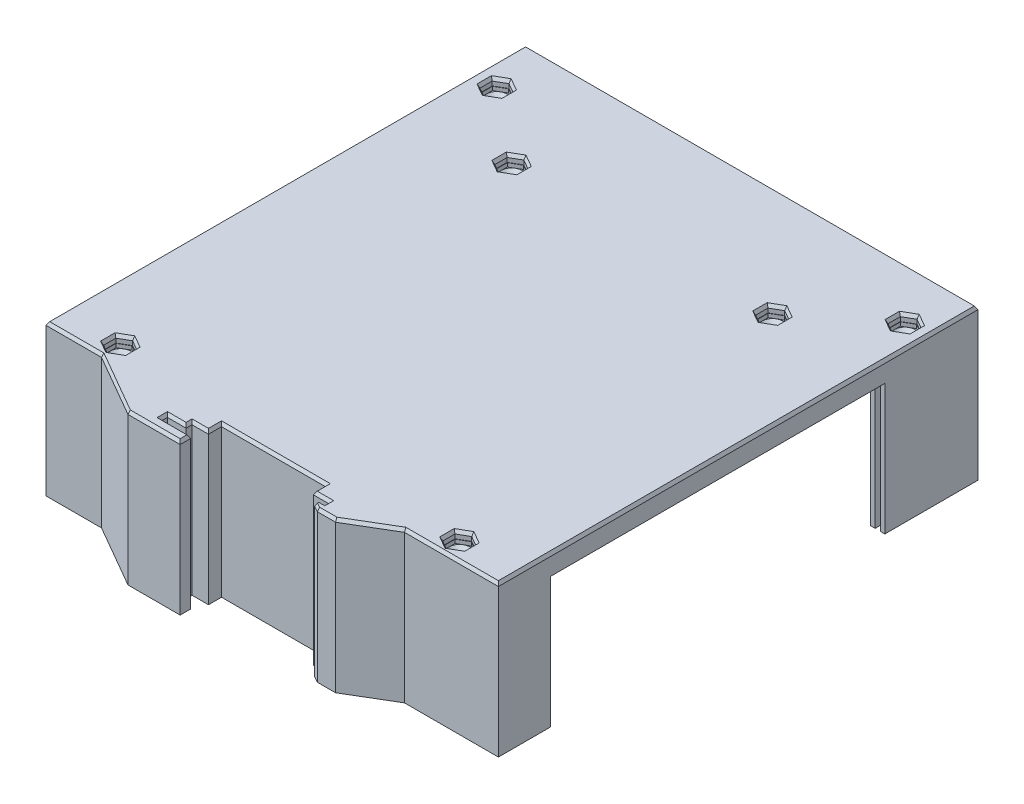
from build123d import *

# Parameters (mm, degrees)
SKETCH_1_W            = 121.4
SKETCH_1_H            = 128.7
EXTRUDE_1_DEPTH       = 1.5
SKETCH_2_W            = 121.4
SKETCH_2_H            = 128.7
SKETCH_2_W_2          = 113.8
SKETCH_2_H_2          = 116.9
SKETCH_2_W_3          = 36
SKETCH_2_H_3          = 4.6
SKETCH_2_W_4          = 20
EXTRUDE_2_DEPTH       = 2
SKETCH_3_W            = 1.5
SKETCH_3_H            = 96.8
SKETCH_3_W_2          = 113.8
SKETCH_3_H_2          = 1.5
EXTRUDE_3_DEPTH       = 2
EXTRUDE_4_DEPTH       = 35
SKETCH_5_R            = 3.15
EXTRUDE_5_DEPTH       = 39
EXTRUDE_6_REACH       = 183.17
SKETCH_6_R            = 4.75
SKETCH_7_W            = 121.4
SKETCH_7_H            = 8
SKETCH_7_W_2          = 36
SKETCH_7_H_2          = 4.6
SKETCH_7_W_3          = 20
EXTRUDE_7_DEPTH       = 37
EXTRUDE_15_DEPTH      = 3.8
SKETCH_9_R            = 4.75
SKETCH_9_W            = 2.2
SKETCH_9_H            = 2.2
EXTRUDE_9_DEPTH       = 4
CUT_EXTRUDE_1_REACH   = 184.385
SKETCH_10_R           = 1.75
CUT_EXTRUDE_2_DEPTH   = 3
EXTRUDE_10_DEPTH      = 40.5
EXTRUDE_11_DEPTH      = 40.5
CHAMFER_2_SIZE        = 1
CHAMFER_3_SIZE        = 0.5
CHAMFER_3_SIZE2       = 0.866025404
CHAMFER_4_SIZE        = 0.5
CHAMFER_4_SIZE2       = 0.866025404
EXTRUDE_12_REACH      = 184.026
EXTRUDE_13_DEPTH      = 2.2
EXTRUDE_13_DEPTH_BACK = 2.2
EXTRUDE_14_DEPTH      = 2.2
EXTRUDE_14_DEPTH_BACK = 2.2
EXTRUDE_16_DEPTH      = 1


with BuildPart() as part:
    # Эскиз1 → Бобышка-Вытянуть1 (new body)
    with BuildSketch(Plane(origin=(0, 0, 0), x_dir=(1, 0, 0), z_dir=(0, 1, 0))):
        with Locations((60.7, 64.35)):
            Rectangle(SKETCH_1_W, SKETCH_1_H)
    extrude(amount=EXTRUDE_1_DEPTH)

    # Эскиз2 → Бобышка-Вытянуть2 (add)
    with BuildSketch(Plane.XZ):
        with Locations((60.7, -64.35)):
            Rectangle(SKETCH_2_W, SKETCH_2_H)
        with Locations((60.7, -66.45)):
            Rectangle(SKETCH_2_W_2, SKETCH_2_H_2, mode=Mode.SUBTRACT)
        with Locations((101.7, -4)):
            Rectangle(SKETCH_2_W_3, SKETCH_2_H_3, mode=Mode.SUBTRACT)
        with Locations((19.7, -4)):
            Rectangle(SKETCH_2_W_3, SKETCH_2_H_3, mode=Mode.SUBTRACT)
        with Locations((71.7, -4)):
            Rectangle(SKETCH_2_W_4, SKETCH_2_H_3, mode=Mode.SUBTRACT)
        with Locations((49.7, -4)):
            Rectangle(SKETCH_2_W_4, SKETCH_2_H_3, mode=Mode.SUBTRACT)
    extrude(amount=EXTRUDE_2_DEPTH)

    # Эскиз3 → Бобышка-Вытянуть3 (add)
    with BuildSketch(Plane.XZ.offset(2)):
        Polygon((117.6, -8), (121.4, -8), (121.4, -128.7), (0, -128.7), (0, -8), (3.8, -8), (3.8, -124.9), (117.6, -124.9), align=None)
        with Locations((119.55, -59)):
            Rectangle(SKETCH_3_W, SKETCH_3_H, mode=Mode.SUBTRACT)
        with Locations((60.7, -126.85)):
            Rectangle(SKETCH_3_W_2, SKETCH_3_H_2, mode=Mode.SUBTRACT)
        with Locations((1.85, -59)):
            Rectangle(SKETCH_3_W, SKETCH_3_H, mode=Mode.SUBTRACT)
    extrude(amount=EXTRUDE_3_DEPTH)

    # Эскиз4 → Бобышка-Вытянуть4 (add)
    with BuildSketch(Plane.XZ.offset(4)):
        Polygon((121.4, -8), (121.4, -14), (120.3, -14), (120.3, -10.6), (118.8, -10.6), (118.8, -14), (117.6, -14), (117.6, -8), align=None)
        Polygon((3.8, -8), (0, -8), (0, -14), (1.1, -14), (1.1, -10.6), (2.6, -10.6), (2.6, -14), (3.8, -14), align=None)
        Polygon((121.4, -128.7), (121.4, -103.7), (120.3, -103.7), (120.3, -107.4), (118.8, -107.4), (118.8, -103.7), (117.6, -103.7), (117.6, -124.9), (113.4, -124.9), (113.4, -126.1), (117.6, -126.1), (117.6, -127.6), (113.4, -127.6), (113.4, -128.7), align=None)
        Polygon((8, -124.9), (3.8, -124.9), (3.8, -103.7), (2.6, -103.7), (2.6, -107.4), (1.1, -107.4), (1.1, -103.7), (0, -103.7), (0, -128.7), (8, -128.7), (8, -127.6), (3.8, -127.6), (3.8, -126.1), (8, -126.1), align=None)
    extrude(amount=EXTRUDE_4_DEPTH)

    # Эскиз5 → Бобышка-Вытянуть5 (add)
    with BuildSketch(Plane.XZ):
        with Locations(Location((106.2, -4.75, 0), (0, 0, 75.52435158))):
            Circle(SKETCH_5_R)
        with Locations(Location((15.2, -4.75, 0), (0, 0, 104.47564842))):
            Circle(SKETCH_5_R)
        with Locations((115.45, -115)):
            Circle(SKETCH_5_R)
        with Locations((5.95, -115)):
            Circle(SKETCH_5_R)
    extrude(amount=EXTRUDE_5_DEPTH)

    # Бобышка-Вытянуть6: up to this face of the body (flat: up to its plane)
    extrude_6_end = Plane(part.part.faces().sort_by_distance((118.2, -4, -58.85))[0])
    # Эскиз6 → Бобышка-Вытянуть6 (add, up to the picked face)
    with BuildSketch(Plane.XZ, mode=Mode.PRIVATE) as extrude_6_sk1:
        with Locations((115.45, -115)):
            Circle(SKETCH_6_R)
    extrude_6_tool1 = split(extrude(extrude_6_sk1.sketch, amount=EXTRUDE_6_REACH, mode=Mode.PRIVATE), bisect_by=extrude_6_end, keep=Keep.BOTH, mode=Mode.PRIVATE)
    # Эскиз6 → Бобышка-Вытянуть6 (add, up to the picked face)
    with BuildSketch(Plane.XZ, mode=Mode.PRIVATE) as extrude_6_sk2:
        with Locations(Location((106.2, -4.75, 0), (0, 0, 90))):
            Circle(SKETCH_6_R)
    extrude_6_tool2 = split(extrude(extrude_6_sk2.sketch, amount=EXTRUDE_6_REACH, mode=Mode.PRIVATE), bisect_by=extrude_6_end, keep=Keep.BOTH, mode=Mode.PRIVATE)
    # Эскиз6 → Бобышка-Вытянуть6 (add, up to the picked face)
    with BuildSketch(Plane.XZ, mode=Mode.PRIVATE) as extrude_6_sk3:
        with Locations(Location((15.2, -4.75, 0), (0, 0, 90))):
            Circle(SKETCH_6_R)
    extrude_6_tool3 = split(extrude(extrude_6_sk3.sketch, amount=EXTRUDE_6_REACH, mode=Mode.PRIVATE), bisect_by=extrude_6_end, keep=Keep.BOTH, mode=Mode.PRIVATE)
    # Эскиз6 → Бобышка-Вытянуть6 (add, up to the picked face)
    with BuildSketch(Plane.XZ, mode=Mode.PRIVATE) as extrude_6_sk4:
        with Locations((5.95, -115)):
            Circle(SKETCH_6_R)
    extrude_6_tool4 = split(extrude(extrude_6_sk4.sketch, amount=EXTRUDE_6_REACH, mode=Mode.PRIVATE), bisect_by=extrude_6_end, keep=Keep.BOTH, mode=Mode.PRIVATE)
    add(extrude_6_tool1.solids().sort_by(Axis((115.45, 0, -115), (0, -1, 0)))[0])
    add(extrude_6_tool2.solids().sort_by(Axis((106.2, 0, -4.75), (0, -1, 0)))[0])
    add(extrude_6_tool3.solids().sort_by(Axis((15.2, 0, -4.75), (0, -1, 0)))[0])
    add(extrude_6_tool4.solids().sort_by(Axis((5.95, 0, -115), (0, -1, 0)))[0])

    # Эскиз7 → Бобышка-Вытянуть7 (add)
    with BuildSketch(Plane.XZ.offset(2)):
        with Locations((60.7, -4)):
            Rectangle(SKETCH_7_W, SKETCH_7_H)
        with Locations((101.7, -4)):
            Rectangle(SKETCH_7_W_2, SKETCH_7_H_2, mode=Mode.SUBTRACT)
        with Locations((71.7, -4)):
            Rectangle(SKETCH_7_W_3, SKETCH_7_H_2, mode=Mode.SUBTRACT)
        with Locations((49.7, -4)):
            Rectangle(SKETCH_7_W_3, SKETCH_7_H_2, mode=Mode.SUBTRACT)
        with Locations((19.7, -4)):
            Rectangle(SKETCH_7_W_2, SKETCH_7_H_2, mode=Mode.SUBTRACT)
    extrude(amount=EXTRUDE_7_DEPTH)

    # Эскиз8 → Бобышка-Вытянуть15 (add)
    with BuildSketch(Plane.XZ.offset(39)):
        Polygon((83.7, -8), (83.7, -1.7), (81.7, -1.7), (81.7, -6.3), (39.7, -6.3), (39.7, -1.7), (37.7, -1.7), (37.7, -8), align=None)
    extrude(amount=EXTRUDE_15_DEPTH)

    # Эскиз9 → Бобышка-Вытянуть9 (add)
    with BuildSketch(Plane.XZ):
        with Locations(Location((95.7, -99.24, 0), (0, 0, 90))):
            Circle(SKETCH_9_R)
        with Locations(Location((25.7, -99.24, 0), (0, 0, 90))):
            Circle(SKETCH_9_R)
        with Locations((60.7, -123.8)):
            Rectangle(SKETCH_9_W, SKETCH_9_H)
        with Locations((102.9, -123.8)):
            Rectangle(SKETCH_9_W, SKETCH_9_H)
        with Locations((18.5, -123.8)):
            Rectangle(SKETCH_9_W, SKETCH_9_H)
        with Locations((116.5, -99.3)):
            Rectangle(SKETCH_9_W, SKETCH_9_H)
        with Locations((116.5, -17.1)):
            Rectangle(SKETCH_9_W, SKETCH_9_H)
        with Locations((60.7, -9.1)):
            Rectangle(SKETCH_9_W, SKETCH_9_H)
        with Locations((4.9, -17.1)):
            Rectangle(SKETCH_9_W, SKETCH_9_H)
        with Locations((4.9, -99.3)):
            Rectangle(SKETCH_9_W, SKETCH_9_H)
    extrude(amount=EXTRUDE_9_DEPTH)

    # Вырез-Вытянуть1: up to this face of the body (flat: up to its plane)
    cut_extrude_1_end = Plane(part.part.faces().sort_by_distance((118.237912368, -39, -117.203937883))[0])
    # Эскиз10 → Вырез-Вытянуть1 (cut, up to the picked face)
    with BuildSketch(Plane(origin=(0, 1.5, 0), x_dir=(1, 0, 0), z_dir=(0, 1, 0)), mode=Mode.PRIVATE) as cut_extrude_1_sk1:
        with Locations(Location((5.95, 115, 0), (0, 0, 270))):
            Circle(SKETCH_10_R)
    cut_extrude_1_tool1 = split(extrude(cut_extrude_1_sk1.sketch, amount=-CUT_EXTRUDE_1_REACH, mode=Mode.PRIVATE), bisect_by=cut_extrude_1_end, keep=Keep.BOTH, mode=Mode.PRIVATE)
    # Эскиз10 → Вырез-Вытянуть1 (cut, up to the picked face)
    with BuildSketch(Plane(origin=(0, 1.5, 0), x_dir=(1, 0, 0), z_dir=(0, 1, 0)), mode=Mode.PRIVATE) as cut_extrude_1_sk2:
        with Locations(Location((115.45, 115, 0), (0, 0, 270))):
            Circle(SKETCH_10_R)
    cut_extrude_1_tool2 = split(extrude(cut_extrude_1_sk2.sketch, amount=-CUT_EXTRUDE_1_REACH, mode=Mode.PRIVATE), bisect_by=cut_extrude_1_end, keep=Keep.BOTH, mode=Mode.PRIVATE)
    # Эскиз10 → Вырез-Вытянуть1 (cut, up to the picked face)
    with BuildSketch(Plane(origin=(0, 1.5, 0), x_dir=(1, 0, 0), z_dir=(0, 1, 0)), mode=Mode.PRIVATE) as cut_extrude_1_sk3:
        with Locations(Location((15.2, 4.75, 0), (0, 0, 270))):
            Circle(SKETCH_10_R)
    cut_extrude_1_tool3 = split(extrude(cut_extrude_1_sk3.sketch, amount=-CUT_EXTRUDE_1_REACH, mode=Mode.PRIVATE), bisect_by=cut_extrude_1_end, keep=Keep.BOTH, mode=Mode.PRIVATE)
    # Эскиз10 → Вырез-Вытянуть1 (cut, up to the picked face)
    with BuildSketch(Plane(origin=(0, 1.5, 0), x_dir=(1, 0, 0), z_dir=(0, 1, 0)), mode=Mode.PRIVATE) as cut_extrude_1_sk4:
        with Locations(Location((106.2, 4.75, 0), (0, 0, 270))):
            Circle(SKETCH_10_R)
    cut_extrude_1_tool4 = split(extrude(cut_extrude_1_sk4.sketch, amount=-CUT_EXTRUDE_1_REACH, mode=Mode.PRIVATE), bisect_by=cut_extrude_1_end, keep=Keep.BOTH, mode=Mode.PRIVATE)
    # Эскиз10 → Вырез-Вытянуть1 (cut, up to the picked face)
    with BuildSketch(Plane(origin=(0, 1.5, 0), x_dir=(1, 0, 0), z_dir=(0, 1, 0)), mode=Mode.PRIVATE) as cut_extrude_1_sk5:
        with Locations(Location((25.7, 99.24, 0), (0, 0, 270))):
            Circle(SKETCH_10_R)
    cut_extrude_1_tool5 = split(extrude(cut_extrude_1_sk5.sketch, amount=-CUT_EXTRUDE_1_REACH, mode=Mode.PRIVATE), bisect_by=cut_extrude_1_end, keep=Keep.BOTH, mode=Mode.PRIVATE)
    # Эскиз10 → Вырез-Вытянуть1 (cut, up to the picked face)
    with BuildSketch(Plane(origin=(0, 1.5, 0), x_dir=(1, 0, 0), z_dir=(0, 1, 0)), mode=Mode.PRIVATE) as cut_extrude_1_sk6:
        with Locations(Location((95.7, 99.24, 0), (0, 0, 270))):
            Circle(SKETCH_10_R)
    cut_extrude_1_tool6 = split(extrude(cut_extrude_1_sk6.sketch, amount=-CUT_EXTRUDE_1_REACH, mode=Mode.PRIVATE), bisect_by=cut_extrude_1_end, keep=Keep.BOTH, mode=Mode.PRIVATE)
    add(cut_extrude_1_tool1.solids().sort_by(Axis((5.95, 1.5, -115), (0, -1, 0)))[0], mode=Mode.SUBTRACT)
    add(cut_extrude_1_tool2.solids().sort_by(Axis((115.45, 1.5, -115), (0, -1, 0)))[0], mode=Mode.SUBTRACT)
    add(cut_extrude_1_tool3.solids().sort_by(Axis((15.2, 1.5, -4.75), (0, -1, 0)))[0], mode=Mode.SUBTRACT)
    add(cut_extrude_1_tool4.solids().sort_by(Axis((106.2, 1.5, -4.75), (0, -1, 0)))[0], mode=Mode.SUBTRACT)
    add(cut_extrude_1_tool5.solids().sort_by(Axis((25.7, 1.5, -99.24), (0, -1, 0)))[0], mode=Mode.SUBTRACT)
    add(cut_extrude_1_tool6.solids().sort_by(Axis((95.7, 1.5, -99.24), (0, -1, 0)))[0], mode=Mode.SUBTRACT)

    # Эскиз11 → Вырез-Вытянуть2 (cut)
    with BuildSketch(Plane(origin=(0, 1.5, 0), x_dir=(1, 0, 0), z_dir=(0, 1, 0))):
        Polygon((3.1, 116.645448267), (3.1, 113.354551733), (5.95, 111.709103466), (8.8, 113.354551733), (8.8, 116.645448267), (5.95, 118.290896534), align=None)
        Polygon((112.6, 116.645448267), (112.6, 113.354551733), (115.45, 111.709103466), (118.3, 113.354551733), (118.3, 116.645448267), (115.45, 118.290896534), align=None)
        Polygon((22.85, 100.885448267), (22.85, 97.594551733), (25.7, 95.949103466), (28.55, 97.594551733), (28.55, 100.885448267), (25.7, 102.530896534), align=None)
        Polygon((98.55, 100.885448267), (95.7, 102.530896534), (92.85, 100.885448267), (92.85, 97.594551733), (95.7, 95.949103466), (98.55, 97.594551733), align=None)
        Polygon((18.05, 6.395448267), (15.2, 8.040896534), (12.35, 6.395448267), (12.35, 3.104551733), (15.2, 1.459103466), (18.05, 3.104551733), align=None)
        Polygon((109.05, 6.395448267), (106.2, 8.040896534), (103.35, 6.395448267), (103.35, 3.104551733), (106.2, 1.459103466), (109.05, 3.104551733), align=None)
    extrude(amount=-CUT_EXTRUDE_2_DEPTH, mode=Mode.SUBTRACT)

    # Эскиз12 → Бобышка-Вытянуть10 (add)
    with BuildSketch(Plane(origin=(0, 1.5, 0), x_dir=(1, 0, 0), z_dir=(0, 1, 0))):
        Polygon((96.2, 0), (75.3, 0), (75.3, -3.5), (79.7, -3.5), (79.7, -4.9), (78.1, -4.9), (78.1, -6), (79.7, -6.9), (84.6, -6.9), align=None)
    extrude(amount=-EXTRUDE_10_DEPTH)

    # Эскиз13 → Бобышка-Вытянуть11 (add)
    with BuildSketch(Plane(origin=(0, 1.5, 0), x_dir=(1, 0, 0), z_dir=(0, 1, 0))):
        Polygon((31.7, -9.7), (14.899107167, 0), (47.1, 0), (47.1, -3.5), (42.7, -3.5), (42.7, -5.1), (37.7, -5.1), (37.7, -6.9), (45.7, -6.9), (45.7, -9.7), align=None)
    extrude(amount=-EXTRUDE_11_DEPTH)

    # Эскиз14 → Повернуть1 (revolve)
    with BuildSketch(Plane(origin=(0, -18.75, 0), x_dir=(1, 0, 0), z_dir=(0, 1, 0)), mode=Mode.PRIVATE) as revolve_1_sk:
        Polygon((41.7, -6.9), (41.7, -5.9), (39.5, -6.9), align=None)
    revolve(revolve_1_sk.sketch.rotate(Axis((41.7, -18.75, 6.9), (0, 0, -1)), 180), axis=Axis((41.7, -18.75, 6.9), (0, 0, -1)))

    # Фаска2
    chamfer_2_edges = [part.edges().sort_by_distance(p)[0] for p in [
        (5.95, -1.5, -116.75),
        (106.2, -1.5, -6.5),
        (15.2, -1.5, -6.5),
        (25.7, -1.5, -100.99),
        (95.7, -1.5, -100.99),
        (115.45, -1.5, -116.75),
    ]]
    chamfer(chamfer_2_edges, length=CHAMFER_2_SIZE)

    # Фаска3
    chamfer_3_edges = [part.edges().sort_by_distance(p)[0] for p in [
        (60.7, 1.5, -128.7),
        (0, 1.5, -64.35),
        (7.449553583, 1.5, 0),
        (108.8, 1.5, 0),
        (90.4, 1.5, 3.45),
        (75.3, 1.5, 1.75),
        (77.5, 1.5, 3.5),
        (79.7, 1.5, 4.2),
        (78.9, 1.5, 4.9),
        (78.1, 1.5, 5.45),
        (78.9, 1.5, 6.45),
        (82.15, 1.5, 6.9),
        (61.2, 1.5, 0),
        (38.7, 1.5, 9.7),
        (45.7, 1.5, 8.3),
        (41.7, 1.5, 6.9),
        (37.7, 1.5, 6),
        (40.2, 1.5, 5.1),
        (42.7, 1.5, 4.3),
        (44.9, 1.5, 3.5),
        (47.1, 1.5, 1.75),
        (23.299553583, 1.5, 4.85),
        (121.4, 1.5, -64.35),
    ]]
    chamfer_3_side = [part.faces().sort_by_distance(p)[0] for p in [
        (60.485158949, 1.5, -62.985132335),
    ]]
    chamfer(chamfer_3_edges, length=CHAMFER_3_SIZE, length2=CHAMFER_3_SIZE2, reference=chamfer_3_side[0])

    # Фаска4
    chamfer_4_edges = [part.edges().sort_by_distance(p)[0] for p in [
        (4.525, 1.5, -117.468172401),
        (3.1, 1.5, -115),
        (4.525, 1.5, -112.531827599),
        (7.375, 1.5, -112.531827599),
        (8.8, 1.5, -115),
        (7.375, 1.5, -117.468172401),
        (109.05, 1.5, -4.75),
        (107.625, 1.5, -7.218172401),
        (104.775, 1.5, -7.218172401),
        (103.35, 1.5, -4.75),
        (104.775, 1.5, -2.281827599),
        (107.625, 1.5, -2.281827599),
        (18.05, 1.5, -4.75),
        (16.625, 1.5, -7.218172401),
        (13.775, 1.5, -7.218172401),
        (12.35, 1.5, -4.75),
        (13.775, 1.5, -2.281827599),
        (16.625, 1.5, -2.281827599),
        (24.275, 1.5, -101.708172401),
        (22.85, 1.5, -99.24),
        (24.275, 1.5, -96.771827599),
        (27.125, 1.5, -96.771827599),
        (28.55, 1.5, -99.24),
        (27.125, 1.5, -101.708172401),
        (98.55, 1.5, -99.24),
        (97.125, 1.5, -101.708172401),
        (94.275, 1.5, -101.708172401),
        (92.85, 1.5, -99.24),
        (94.275, 1.5, -96.771827599),
        (97.125, 1.5, -96.771827599),
        (114.025, 1.5, -117.468172401),
        (112.6, 1.5, -115),
        (114.025, 1.5, -112.531827599),
        (116.875, 1.5, -112.531827599),
        (118.3, 1.5, -115),
        (116.875, 1.5, -117.468172401),
    ]]
    chamfer_4_side = [part.faces().sort_by_distance(p)[0] for p in [
        (60.492769337, 1.5, -63.059990374),
    ]]
    chamfer(chamfer_4_edges, length=CHAMFER_4_SIZE, length2=CHAMFER_4_SIZE2, reference=chamfer_4_side[0])

    # Бобышка-Вытянуть12: up to this face of the body (flat: up to its plane)
    extrude_12_end = Plane(part.part.faces().sort_by_distance((2.933766911, -39, -117.384433042))[0])
    # Эскиз15 → Бобышка-Вытянуть12 (add, up to the picked face)
    with BuildSketch(Plane.XZ, mode=Mode.PRIVATE) as extrude_12_sk1:
        Polygon((8, -124.9), (3.8, -124.9), (3.8, -119.235563717), align=None)
    extrude_12_tool1 = split(extrude(extrude_12_sk1.sketch, amount=EXTRUDE_12_REACH, mode=Mode.PRIVATE), bisect_by=extrude_12_end, keep=Keep.BOTH, mode=Mode.PRIVATE)
    # Эскиз15 → Бобышка-Вытянуть12 (add, up to the picked face)
    with BuildSketch(Plane.XZ, mode=Mode.PRIVATE) as extrude_12_sk2:
        Polygon((113.4, -124.9), (117.6, -124.9), (117.6, -119.235563717), align=None)
    extrude_12_tool2 = split(extrude(extrude_12_sk2.sketch, amount=EXTRUDE_12_REACH, mode=Mode.PRIVATE), bisect_by=extrude_12_end, keep=Keep.BOTH, mode=Mode.PRIVATE)
    add(extrude_12_tool1.solids().sort_by(Axis((5.2, 0, -123.011855), (0, -1, 0)))[0])
    add(extrude_12_tool2.solids().sort_by(Axis((116.2, 0, -123.011855), (0, -1, 0)))[0])

    # Эскиз16 → Бобышка-Вытянуть13 (add, two sides: drawn at the far end of the back side and taken through both)
    with BuildSketch(Plane(origin=(79.8, 0, 0), x_dir=(0, 0, -1), z_dir=(1, 0, 0)).offset(-EXTRUDE_13_DEPTH_BACK)):
        Polygon((8, -4), (9.65, -7), (8, -10), align=None)
    extrude(amount=EXTRUDE_13_DEPTH + EXTRUDE_13_DEPTH_BACK)

    # Эскиз18 → Бобышка-Вытянуть14 (add, two sides: drawn at the far end of the back side and taken through both)
    with BuildSketch(Plane.ZY.offset(-41.6).offset(-EXTRUDE_14_DEPTH_BACK)):
        Polygon((-8, -4), (-9.65, -7), (-8, -10), align=None)
    extrude(amount=EXTRUDE_14_DEPTH + EXTRUDE_14_DEPTH_BACK)

    # Эскиз19 → Бобышка-Вытянуть16 (add)
    # profile 1 of 6: a face of its own
    with BuildSketch(Plane(origin=(0, -1.5, 0), x_dir=(1, 0, 0), z_dir=(0, 1, 0))):
        Polygon((112.6, 113.354551733), (115.45, 111.709103466), (118.3, 113.354551733), (118.3, 116.645448267), (115.45, 118.290896534), (112.6, 116.645448267), align=None)
        Polygon((112.7, 113.41228676), (115.45, 111.824573519), (118.2, 113.41228676), (118.2, 116.58771324), (115.45, 118.175426481), (112.7, 116.58771324), align=None, mode=Mode.SUBTRACT)
    # profile 2 of 6: a face of its own
    with BuildSketch(Plane(origin=(0, -1.5, 0), x_dir=(1, 0, 0), z_dir=(0, 1, 0))):
        Polygon((92.85, 97.594551733), (95.7, 95.949103466), (98.55, 97.594551733), (98.55, 100.885448267), (95.7, 102.530896534), (92.85, 100.885448267), align=None)
        Polygon((92.95, 97.65228676), (95.7, 96.064573519), (98.45, 97.65228676), (98.45, 100.82771324), (95.7, 102.415426481), (92.95, 100.82771324), align=None, mode=Mode.SUBTRACT)
    # profile 3 of 6: a face of its own
    with BuildSketch(Plane(origin=(0, -1.5, 0), x_dir=(1, 0, 0), z_dir=(0, 1, 0))):
        Polygon((22.85, 97.594551733), (25.7, 95.949103466), (28.55, 97.594551733), (28.55, 100.885448267), (25.7, 102.530896534), (22.85, 100.885448267), align=None)
        Polygon((22.95, 97.65228676), (25.7, 96.064573519), (28.45, 97.65228676), (28.45, 100.82771324), (25.7, 102.415426481), (22.95, 100.82771324), align=None, mode=Mode.SUBTRACT)
    # profile 4 of 6: a face of its own
    with BuildSketch(Plane(origin=(0, -1.5, 0), x_dir=(1, 0, 0), z_dir=(0, 1, 0))):
        Polygon((3.1, 113.354551733), (5.95, 111.709103466), (8.8, 113.354551733), (8.8, 116.645448267), (5.95, 118.290896534), (3.1, 116.645448267), align=None)
        Polygon((3.2, 113.41228676), (5.95, 111.824573519), (8.7, 113.41228676), (8.7, 116.58771324), (5.95, 118.175426481), (3.2, 116.58771324), align=None, mode=Mode.SUBTRACT)
    # profile 5 of 6: a face of its own
    with BuildSketch(Plane(origin=(0, -1.5, 0), x_dir=(1, 0, 0), z_dir=(0, 1, 0))):
        Polygon((12.35, 3.104551733), (15.2, 1.459103466), (18.05, 3.104551733), (18.05, 6.395448267), (15.2, 8.040896534), (12.35, 6.395448267), align=None)
        Polygon((12.45, 3.16228676), (15.2, 1.574573519), (17.95, 3.16228676), (17.95, 6.33771324), (15.2, 7.925426481), (12.45, 6.33771324), align=None, mode=Mode.SUBTRACT)
    # profile 6 of 6: a face of its own
    with BuildSketch(Plane(origin=(0, -1.5, 0), x_dir=(1, 0, 0), z_dir=(0, 1, 0))):
        Polygon((103.35, 3.104551733), (106.2, 1.459103466), (109.05, 3.104551733), (109.05, 6.395448267), (106.2, 8.040896534), (103.35, 6.395448267), align=None)
        Polygon((103.45, 3.16228676), (106.2, 1.574573519), (108.95, 3.16228676), (108.95, 6.33771324), (106.2, 7.925426481), (103.45, 6.33771324), align=None, mode=Mode.SUBTRACT)
    extrude(amount=EXTRUDE_16_DEPTH)


solid = part.part
